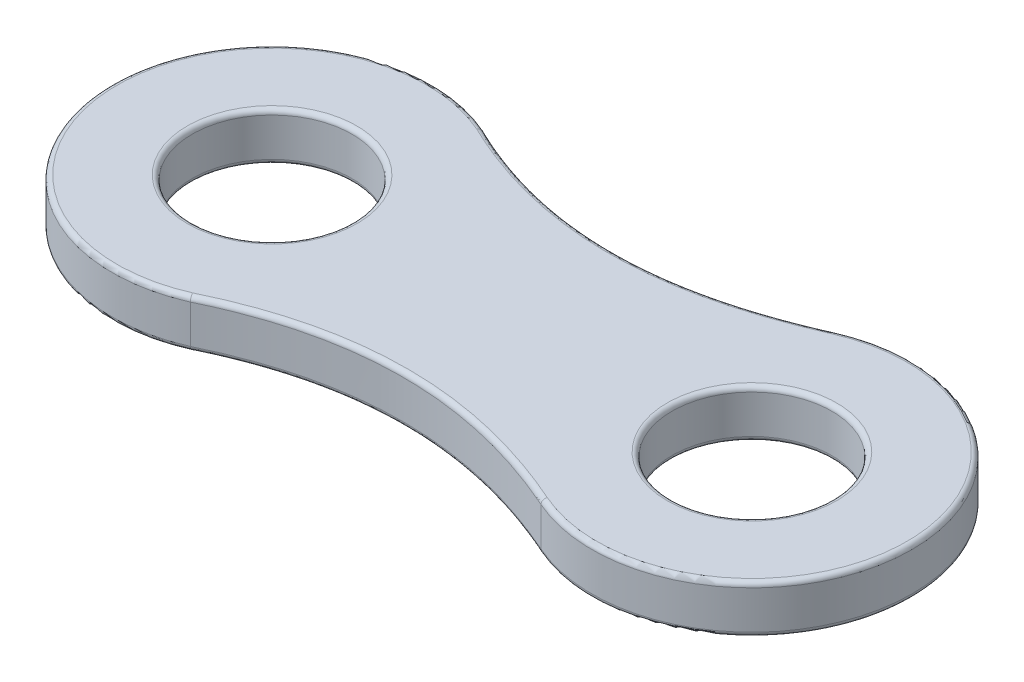
from build123d import *

# Parameters (mm, degrees)
SKETCH2_R           = 0.25
BOSS_EXTRUDE1_DEPTH = 0.15
FILLET1_R           = 0.015


with BuildPart() as part:
    # Sketch2 → Boss-Extrude1 (new body)
    with BuildSketch(Plane(origin=(0, 0, 0), x_dir=(1, 0, 0), z_dir=(0, 1, 0))):
        with BuildLine():
            ThreePointArc((-0.548055874, 0.457404165), (-1.25, 0), (-0.548055874, -0.457404165))
            add(Edge.make_bspline(
                [(-0.548055874, -0.457404165), (-0.160967029, -0.26957617), (0.196289379, -0.302099114), (0.548055874, -0.457404165)],
                knots=[0, 0, 0, 0, 1, 1, 1, 1], degree=3))
            ThreePointArc((0.548055874, -0.457404165), (1.25, 0), (0.548055874, 0.457404165))
            add(Edge.make_bspline(
                [(-0.548055874, 0.457404165), (-0.160967029, 0.26957617), (0.196289379, 0.302099114), (0.548055874, 0.457404165)],
                knots=[0, 0, 0, 0, 1, 1, 1, 1], degree=3))
        make_face()
        with Locations(Location((-0.75, 0, 0), (0, 0, 270))):
            Circle(SKETCH2_R, mode=Mode.SUBTRACT)
        with Locations(Location((0.75, 0, 0), (0, 0, 270))):
            Circle(SKETCH2_R, mode=Mode.SUBTRACT)
    extrude(amount=BOSS_EXTRUDE1_DEPTH)

    # Fillet1
    fillet1_edges = [part.edges().sort_by_distance(p)[0] for p in [
        (-0.000624211, 0.15, -0.32850252),
        (-0.75, 0, -0.25),
        (-0.75, 0.15, -0.25),
        (-1.25, 0.15, 0),
        (0.75, 0, -0.25),
        (0.75, 0.15, -0.25),
        (-0.000624211, 0.15, 0.32850252),
        (-1.25, 0, 0),
        (-0.000624211, 0, -0.32850252),
        (1.25, 0, 0),
        (-0.000624211, 0, 0.32850252),
        (1.25, 0.15, 0),
    ]]
    fillet(fillet1_edges, radius=FILLET1_R)


solid = part.part
